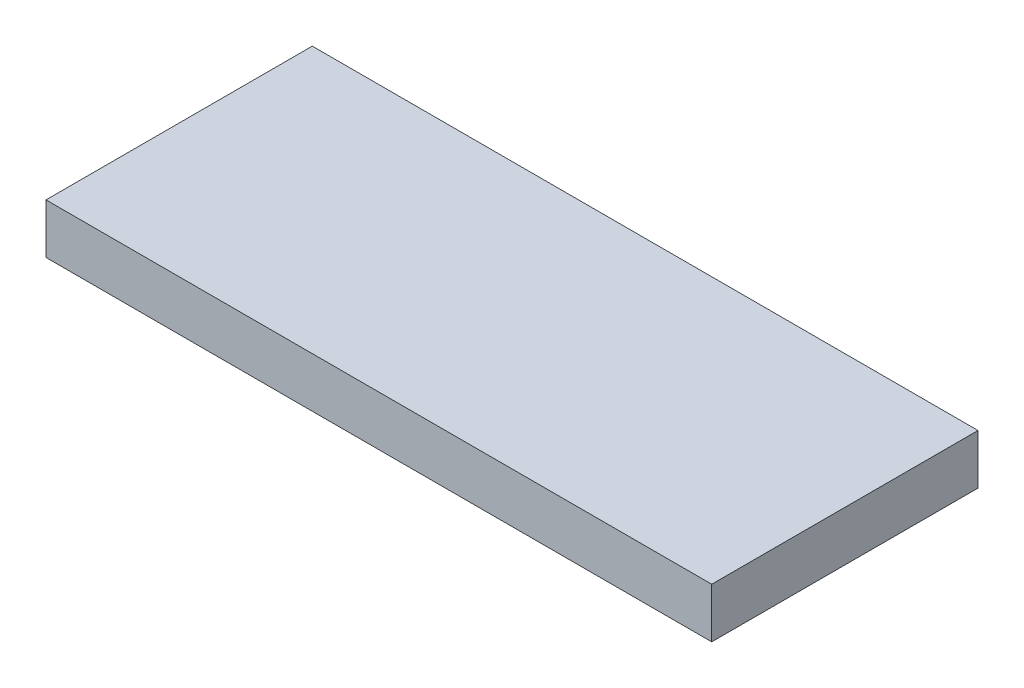
from build123d import *

# Parameters (mm, degrees)
SKETCH1_W           = 20
SKETCH1_H           = 8
BOSS_EXTRUDE1_DEPTH = 1.5


with BuildPart() as part:
    # Sketch1 → Boss-Extrude1 (new body)
    with BuildSketch(Plane(origin=(0, 0, 0), x_dir=(1, 0, 0), z_dir=(0, 1, 0))):
        Rectangle(SKETCH1_W, SKETCH1_H)
    extrude(amount=BOSS_EXTRUDE1_DEPTH)


solid = part.part
